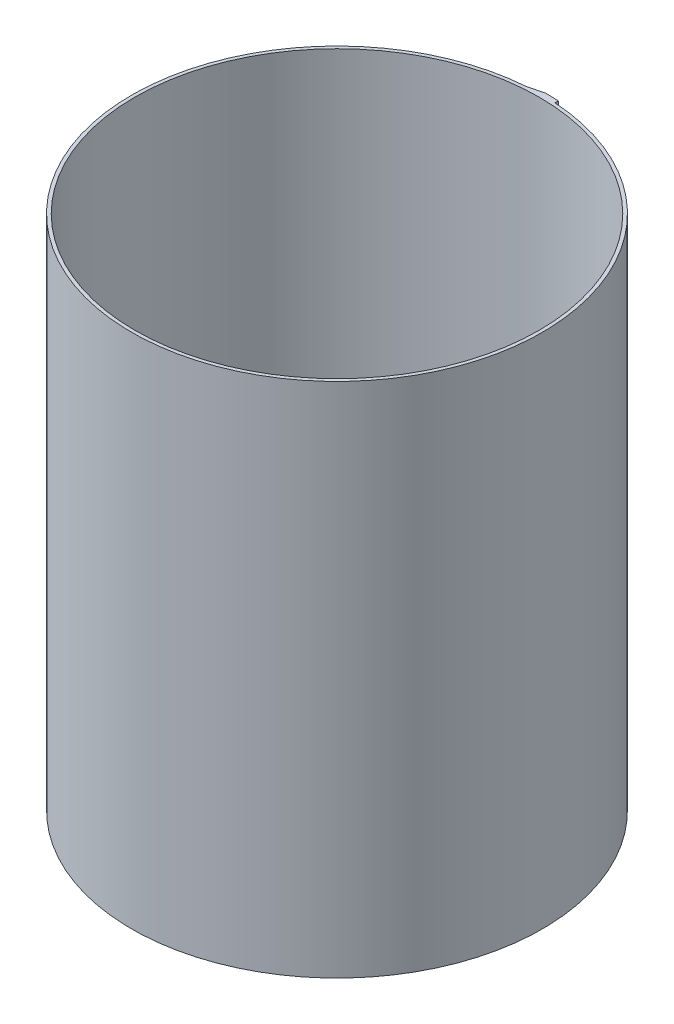
from build123d import *

# Parameters (mm, degrees)
SKETCH1_R           = 63
SKETCH1_R_2         = 61.98
BOSS_EXTRUDE1_DEPTH = 158.49


with BuildPart() as part:
    # Sketch1 → Boss-Extrude1 (new body)
    # profile 1 of 3: a face of its own
    with BuildSketch(Plane(origin=(0, 0, 0), x_dir=(1, 0, 0), z_dir=(0, 1, 0))):
        with BuildLine():
            Line((0, 64.02), (0, 63))
            ThreePointArc((0, 63), (1.984924974, 62.968722973), (3.967879074, 62.874922947))
            Line((3.967879074, 62.874922947), (4.032120926, 63.89289789))
            ThreePointArc((4.032120926, 63.89289789), (2.017061855, 63.988216583), (0, 64.02))
        make_face()
    # profile 2 of 3: a face of its own
    with BuildSketch(Plane(origin=(0, 0, 0), x_dir=(1, 0, 0), z_dir=(0, 1, 0))):
        with BuildLine():
            ThreePointArc((-4.852097182, 62.812874102), (-2.427852094, 62.953201143), (0, 63))
            Line((0, 63), (0, 64.02))
            Line((0, 64.02), (-4.852097182, 62.812874102))
        make_face()
    # profile 3 of 3: a face of its own
    with BuildSketch(Plane(origin=(0, 0, 0), x_dir=(1, 0, 0), z_dir=(0, 1, 0))):
        Circle(SKETCH1_R)
        with Locations(Location((0, 0, 0), (0, 0, 270))):
            Circle(SKETCH1_R_2, mode=Mode.SUBTRACT)
    extrude(amount=BOSS_EXTRUDE1_DEPTH)


solid = part.part
